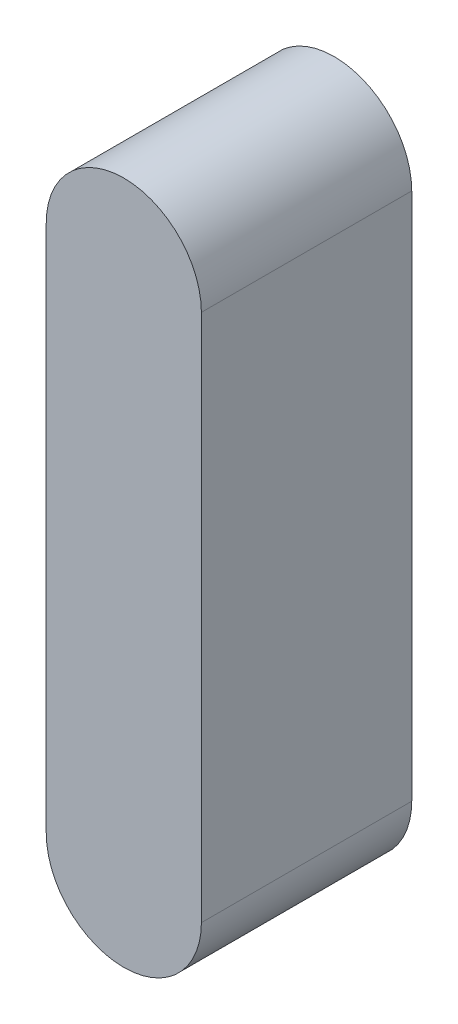
from build123d import *

# Parameters (mm, degrees)
BOSS_EXTRUDE1_DEPTH = 4


with BuildPart() as part:
    # Sketch1 → Boss-Extrude1 (new body)
    with BuildSketch(Plane.XY):
        with BuildLine():
            Line((0, 6.5), (0, -6.5))
            ThreePointArc((0, -6.5), (1.042982502, -6.067982502), (1.475, -5.025))
            Line((1.475, -5.025), (1.475, 5.025))
            ThreePointArc((1.475, 5.025), (1.042982502, 6.067982502), (0, 6.5))
        make_face()
        with BuildLine():
            Line((-1.475, 5.025), (-1.475, -5.025))
            ThreePointArc((-1.475, -5.025), (-1.042982502, -6.067982502), (0, -6.5))
            Line((0, -6.5), (0, 6.5))
            ThreePointArc((0, 6.5), (-1.042982502, 6.067982502), (-1.475, 5.025))
        make_face()
    extrude(amount=BOSS_EXTRUDE1_DEPTH)


solid = part.part
